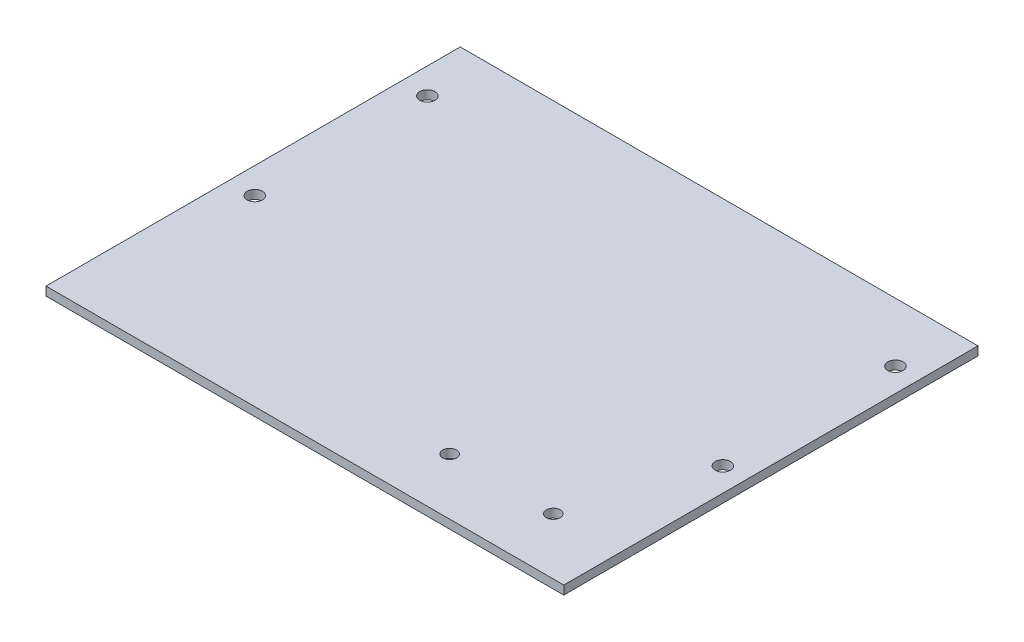
from build123d import *

# Parameters (mm, degrees)
SKETCH1_W            = 95.25
SKETCH1_H            = 76.2
BOSS_EXTRUDE1_DEPTH  = 1.600000102
SKETCH2_R            = 1.397
CUT_EXTRUDE1_DEPTH   = 69.581436034
LPATTERN1_COUNT      = 2
LPATTERN1_PITCH      = 86.106
LPATTERN1_COUNT_DIR2 = 2
LPATTERN1_PITCH_DIR2 = 31.75
SKETCH4_R            = 1.27
CUT_EXTRUDE2_DEPTH   = 69.581436034
LPATTERN2_COUNT      = 2
LPATTERN2_PITCH      = 19.05


with BuildPart() as part:
    # Sketch1 → Boss-Extrude1 (new body)
    with BuildSketch(Plane(origin=(0, 0, 0), x_dir=(1, 0, 0), z_dir=(0, 1, 0))):
        with Locations((1.365591398, 9.866397849)):
            Rectangle(SKETCH1_W, SKETCH1_H)
    extrude(amount=BOSS_EXTRUDE1_DEPTH)

    # Sketch2 → Cut-Extrude1 (cut, through all)
    with BuildSketch(Plane(origin=(0, 1.600000102, 0), x_dir=(1, 0, 0), z_dir=(0, 1, 0))):
        with Locations(Location((-41.471508602, 37.133297849, 0), (0, 0, 270))):
            Circle(SKETCH2_R)
    cut_extrude1 = extrude(amount=-CUT_EXTRUDE1_DEPTH, mode=Mode.SUBTRACT)

    # LPattern1: Cut-Extrude1 2 × 2
    with Locations(*[(i * LPATTERN1_PITCH, 0, j * LPATTERN1_PITCH_DIR2) for i in range(LPATTERN1_COUNT) for j in range(LPATTERN1_COUNT_DIR2) if (i, j) != (0, 0)]):
        add(cut_extrude1, mode=Mode.SUBTRACT)

    # Sketch4 → Cut-Extrude2 (cut, through all)
    with BuildSketch(Plane(origin=(0, 1.600000102, 0), x_dir=(1, 0, 0), z_dir=(0, 1, 0))):
        with Locations(Location((17.613555931, -17.857220142, 0), (0, 0, 270))):
            Circle(SKETCH4_R)
    cut_extrude2 = extrude(amount=-CUT_EXTRUDE2_DEPTH, mode=Mode.SUBTRACT)

    # LPattern2: Cut-Extrude2 ×2
    with Locations(*[(i * LPATTERN2_PITCH, 0, 0) for i in range(1, LPATTERN2_COUNT)]):
        add(cut_extrude2, mode=Mode.SUBTRACT)


solid = part.part
